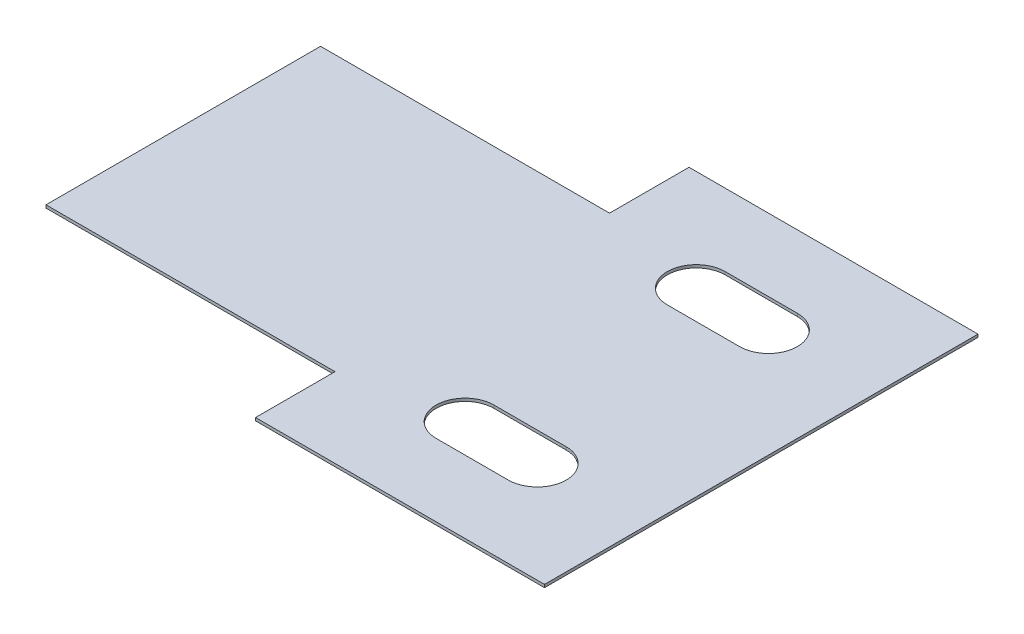
from build123d import *

# Parameters (mm, degrees)
BOSS_EXTRUDE1_DEPTH = 0.05


with BuildPart() as part:
    # Sketch1 → Boss-Extrude1 (new, symmetric)
    with BuildSketch(Plane(origin=(0, 0, 0), x_dir=(1, 0, 0), z_dir=(0, 1, 0))):
        Polygon((-3.778814753, -5.787261175), (6.221185247, -5.787261175), (6.221185247, -8.537261175), (16.221185247, -8.537261175), (16.221185247, 6.462738825), (6.221185247, 6.462738825), (6.221185247, 3.712738825), (-3.778814753, 3.712738825), align=None)
        with BuildLine():
            Line((12.471185247, 3.962738825), (9.971185247, 3.962738825))
            ThreePointArc((9.971185247, 3.962738825), (8.971185247, 2.962738825), (9.971185247, 1.962738825))
            Line((9.971185247, 1.962738825), (12.471185247, 1.962738825))
            ThreePointArc((12.471185247, 1.962738825), (13.471185247, 2.962738825), (12.471185247, 3.962738825))
        make_face(mode=Mode.SUBTRACT)
        with BuildLine():
            Line((12.471185247, -4.037261175), (9.971185247, -4.037261175))
            ThreePointArc((9.971185247, -4.037261175), (8.971185247, -5.037261175), (9.971185247, -6.037261175))
            Line((9.971185247, -6.037261175), (12.471185247, -6.037261175))
            ThreePointArc((12.471185247, -6.037261175), (13.471185247, -5.037261175), (12.471185247, -4.037261175))
        make_face(mode=Mode.SUBTRACT)
    extrude(amount=BOSS_EXTRUDE1_DEPTH, both=True)


solid = part.part
